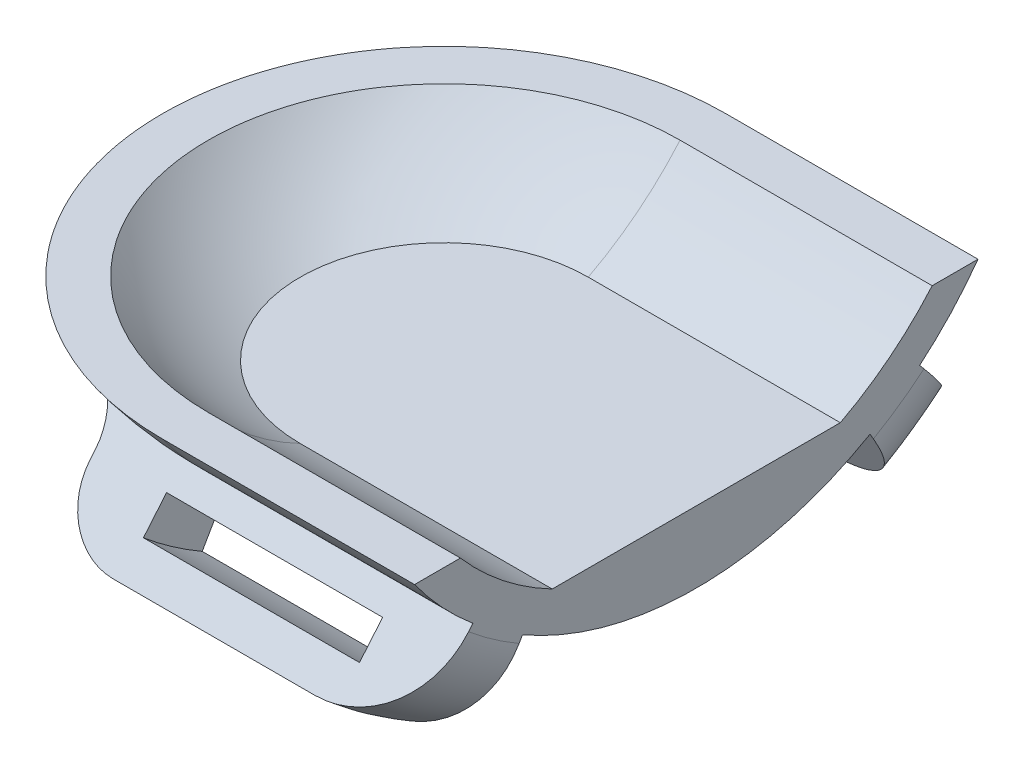
from build123d import *

# Parameters (mm, degrees)
SKETCH2_R                            = 12.2555
SKETCH2_R_2                          = 10.985499999999998
BOSS_EXTRUDE2_DEPTH                  = 15.239999999999998
CUT_EXTRUDE1_DEPTH                   = 24.079258231147723
CUT_EXTRUDE1_DEPTH_BACK              = 24.079258231147723
SKETCH6_W                            = 19.050000000000004
SKETCH6_H                            = 6.349999999999999
BOSS_EXTRUDE3_DEPTH                  = 11.43
BOSS_EXTRUDE3_DIRECTION_2_REACH      = 32.02
BOSS_EXTRUDE3_DIRECTION_2_END_RADIUS = 12.2555
SKETCH7_R                            = 1.4605000000000004
CUT_EXTRUDE3_DEPTH                   = 31.810720873585545
BOSS_EXTRUDE5_REACH                  = 32.02
LPATTERN1_COUNT                      = 3
LPATTERN1_PITCH                      = 5.334
CUT_EXTRUDE4_DEPTH                   = 35.034282139484006
FILLET5_R                            = 5.08
FILLET6_R                            = 2.54
BOSS_EXTRUDE6_REACH                  = 36.034
CUT_EXTRUDE5_DEPTH                   = 31.81072095045976
CUT_EXTRUDE5_DEPTH_BACK              = 31.81072095045976
CUT_EXTRUDE6_DEPTH                   = 31.81072095045976
CUT_EXTRUDE6_DEPTH_BACK              = 31.81072095045976
BOSS_EXTRUDE7_START                  = -12.7
BOSS_EXTRUDE7_DEPTH                  = 12.7
FILLET7_R                            = 2.286
FILLET8_R                            = 3.3019999999999996


with BuildPart() as part:
    # Sketch2 → Boss-Extrude2 (new body)
    with BuildSketch(Plane(origin=(0, 0, 0), x_dir=(0, 0, -1), z_dir=(1, 0, 0))):
        with Locations(Location((0, 0, 0), (0, 0, 180))):
            Circle(SKETCH2_R)
        with Locations(Location((0, 0, 0), (0, 0, 180))):
            Circle(SKETCH2_R_2, mode=Mode.SUBTRACT)
    extrude(amount=BOSS_EXTRUDE2_DEPTH)

    # Sketch3 → Revolve1 (revolve)
    with BuildSketch(Plane(origin=(0, 0, 0), x_dir=(1, 0, 0), z_dir=(0, 1, 0))):
        with BuildLine():
            Line((-12.2555, -1.5e-15), (-10.985499999999998, -1.35e-15))
            ThreePointArc((-10.985499999999998, 1.35e-15), (-7.767921544724782, 7.767921544724851), (9.58e-14, 10.985499999999998))
            Line((6.22e-15, 10.985499999999998), (6.94e-15, 12.2555))
            ThreePointArc((6.19e-15, 12.2555), (-8.665947156831733, 8.665947156831734), (-12.2555, 1.5e-15))
        make_face()
    revolve(axis=Axis((0, 0, 0), (-1, 0, 1.2e-16)))

    # Sketch4 → Cut-Extrude1 (cut, two sides: drawn at the far end of the back side and taken through both)
    with BuildSketch(Plane(origin=(0, 0, 0), x_dir=(1, 0, 0), z_dir=(0, 1, 0)).offset(-CUT_EXTRUDE1_DEPTH_BACK)):
        Polygon((15.239999999999998, 12.2555), (8.889999999999999, 12.255500000000001), (8.890000000000002, -12.255499999999998), (15.240000000000002, -12.2555), align=None)
    extrude(amount=CUT_EXTRUDE1_DEPTH + CUT_EXTRUDE1_DEPTH_BACK, mode=Mode.SUBTRACT)

    # Sketch6 → Boss-Extrude3 (add)
    with BuildSketch(Plane(origin=(0, 12.255499999999998, 0), x_dir=(1, 0, 0), z_dir=(0, 1, 0))):
        with Locations((-0.6349999999999953, 0)):
            Rectangle(SKETCH6_W, SKETCH6_H)
    extrude(amount=BOSS_EXTRUDE3_DEPTH)

    # Boss-Extrude3 direction 2: up to this cylinder (the profile starts outside it)
    boss_extrude3_direction_2_end = Plane(origin=(-0.6349999999999998, 0, 0), z_dir=(-1, 0, 0)) * Cylinder(BOSS_EXTRUDE3_DIRECTION_2_END_RADIUS, 89.551, mode=Mode.PRIVATE)
    # Sketch6 → Boss-Extrude3 direction 2 (add, up to the surface)
    with BuildSketch(Plane(origin=(0, 12.255499999999998, 0), x_dir=(1, 0, 0), z_dir=(0, 1, 0)), mode=Mode.PRIVATE) as boss_extrude3_direction_2_sk1:
        with Locations((-0.6349999999999953, 0)):
            Rectangle(SKETCH6_W, SKETCH6_H)
    boss_extrude3_direction_2_tool1 = extrude(boss_extrude3_direction_2_sk1.sketch, amount=-BOSS_EXTRUDE3_DIRECTION_2_REACH, mode=Mode.PRIVATE) - boss_extrude3_direction_2_end
    add(boss_extrude3_direction_2_tool1.solids().sort_by_distance((-0.635, 12.2555, 0))[0])
    add(boss_extrude3_direction_2_tool1.solids().sort_by_distance((-0.635, 12.2555, 0))[1])

    # Sketch7 → Cut-Extrude3 (cut, through all)
    with BuildSketch(Plane.XY.offset(3.175)):
        with Locations((4.889500000000005, 19.685)):
            Circle(SKETCH7_R)
    cut_extrude3 = extrude(amount=-CUT_EXTRUDE3_DEPTH, mode=Mode.SUBTRACT)

    # Sketch10 → Boss-Extrude5 (add, up to next)
    with BuildSketch(Plane(origin=(0, 12.255499999999998, 0), x_dir=(1, 0, 0), z_dir=(0, 1, 0)), mode=Mode.PRIVATE) as boss_extrude5_sk1:
        Polygon((8.83e-15, -3.175), (8.05e-15, 3.175), (-10.159999999999993, 3.175), (-10.159999999999997, -3.175), align=None)
    boss_extrude5_tool1 = extrude(boss_extrude5_sk1.sketch, amount=-BOSS_EXTRUDE5_REACH, mode=Mode.PRIVATE) - part.part
    add(boss_extrude5_tool1.solids().sort_by_distance((-5.08, 12.2555, 0))[0])

    # LPattern1: Cut-Extrude3 ×3
    with Locations(*[(-i * LPATTERN1_PITCH, 0, 0) for i in range(1, LPATTERN1_COUNT)]):
        add(cut_extrude3, mode=Mode.SUBTRACT)

    # Sketch8 → Cut-Extrude4 (cut, through all)
    with BuildSketch(Plane(origin=(8.89, 0, -1.26e-15), x_dir=(-1.1e-16, 0, -1), z_dir=(1, 0, -1.1e-16))):
        Polygon((-1.5875, 23.685499999999998), (1.5875, 23.685499999999998), (1.5874999999999988, 16.0655), (-1.5874999999999988, 16.0655), align=None)
    extrude(amount=-CUT_EXTRUDE4_DEPTH, mode=Mode.SUBTRACT)

    # Fillet5
    fillet5_edges = [part.edges().sort_by_distance(p)[0] for p in [
        (8.890000000000006, 23.685499999999998, 2.381249999999999),
        (-10.159999999999997, 23.685499999999998, -2.3812499999999996),
        (8.890000000000006, 23.685499999999998, -2.3812500000000005),
        (-10.159999999999997, 23.685499999999998, 2.3812500000000005),
    ]]
    fillet(fillet5_edges, radius=FILLET5_R)

    # Fillet6
    fillet6_edges = [part.edges().sort_by_distance(p)[0] for p in [
        (4.445000000000007, 11.83708812377436, -3.175),
        (4.445000000000007, 11.83708812377436, 3.175),
        (-5.840399850139422, 10.29594021158298, -3.175),
        (-5.840399850139422, 10.295940211582979, 3.175),
        (-10.159999999999995, 6.853588859130672, 4.2e-15),
    ]]
    fillet(fillet6_edges, radius=FILLET6_R)

    # Sketch11 → Boss-Extrude6 (add, up to next)
    with BuildSketch(Plane(origin=(8.89, 0, -1.26e-15), x_dir=(-1.5e-16, 0, -1), z_dir=(1, 0, -1.5e-16)), mode=Mode.PRIVATE) as boss_extrude6_sk1:
        with BuildLine():
            Line((5.08, -9.740370129004337), (-5.08, -9.740370129004337))
            ThreePointArc((-5.080000000000005, -9.740370129004335), (-3.31e-15, -10.985499999999998), (5.08, -9.740370129004337))
        make_face()
    boss_extrude6_tool1 = extrude(boss_extrude6_sk1.sketch, amount=-BOSS_EXTRUDE6_REACH, mode=Mode.PRIVATE) - part.part
    add(boss_extrude6_tool1.solids().sort_by_distance((8.89, -10.240924, 0))[0])

    # Sketch13 → Cut-Extrude5 (cut, two sides: drawn at the far end of the back side and taken through both)
    with BuildSketch(Plane.XY.offset(3.175).offset(-CUT_EXTRUDE5_DEPTH_BACK)):
        with BuildLine():
            Line((6.350000000000005, 14.795499999999999), (-1.2699999999999942, 14.7955))
            Line((-1.2699999999999942, 14.7955), (-1.2699999999999942, 13.587961408909038))
            ThreePointArc((-1.269999999999727, 13.587961408909017), (-0.6356900108532129, 13.632369326720188), (9.77e-15, 13.647182685448303))
            Line((1.089e-14, 13.647182685448303), (6.350000000000005, 13.647182685448303))
            Line((6.350000000000005, 13.647182685448303), (6.350000000000005, 14.795499999999999))
        make_face()
        with BuildLine():
            ThreePointArc((9.77e-15, 13.647182685448303), (-0.6356900108532129, 13.632369326720188), (-1.269999999999727, 13.587961408909017))
            Line((-1.2699999999999942, 13.587961408909038), (-1.269999999999994, 12.2555))
            Line((-1.269999999999994, 12.2555), (6.350000000000005, 12.2555))
            Line((6.350000000000005, 12.2555), (6.350000000000005, 13.647182685448303))
            Line((6.350000000000005, 13.647182685448303), (1.089e-14, 13.647182685448303))
        make_face()
    extrude(amount=CUT_EXTRUDE5_DEPTH + CUT_EXTRUDE5_DEPTH_BACK, mode=Mode.SUBTRACT)

    # Sketch14 → Cut-Extrude6 (cut, two sides: drawn at the far end of the back side and taken through both)
    with BuildSketch(Plane.XY.offset(3.175).offset(-CUT_EXTRUDE6_DEPTH_BACK)):
        Polygon((8.89, -7.175499999999997), (-12.255499999999998, -7.175499999999999), (-12.255500000000003, 23.685499999999998), (8.889999999999999, 23.685500000000005), align=None)
    extrude(amount=CUT_EXTRUDE6_DEPTH + CUT_EXTRUDE6_DEPTH_BACK, mode=Mode.SUBTRACT)

    # Sketch16 → Boss-Extrude7 (add)
    with BuildSketch(Plane(origin=(8.89, 0, -1.26e-15), x_dir=(-1.4e-16, 0, -1), z_dir=(1, 0, -1.4e-16)).offset(BOSS_EXTRUDE7_START)):
        with BuildLine():
            ThreePointArc((-7.397750000000142, -12.813278861692577), (-8.486350164031906, -12.119764071277773), (-9.510364079117075, -11.334010558166936))
            Line((-9.510364079117169, -11.334010558166854), (-10.153151688803709, -12.100055001285837))
            ThreePointArc((-10.153151688803714, -12.100055001285833), (-9.059926600382918, -12.93891611556679), (-7.89774999999997, -13.679304265477118))
            Line((-7.897749999999964, -13.679304265477123), (-7.397749999999962, -12.813278861692677))
        make_face()
        with BuildLine():
            ThreePointArc((-6.127749999999821, -10.61357433608029), (-7.029466015700107, -10.039117878783834), (-7.877683550513282, -9.38825767264472))
            Line((-7.877683550513363, -9.388257672644649), (-9.510364079117169, -11.334010558166854))
            ThreePointArc((-9.510364079117075, -11.334010558166936), (-8.486350164031906, -12.119764071277773), (-7.397750000000142, -12.813278861692577))
            Line((-7.397749999999962, -12.813278861692677), (-6.1277499999999705, -10.613574336080204))
        make_face()
        with BuildLine():
            ThreePointArc((-5.492750000000139, -9.513722073273868), (-6.301023941534394, -8.998794782536732), (-7.061343286211322, -8.415381229883662))
            Line((-7.06134328621146, -8.415381229883545), (-7.877683550513363, -9.388257672644649))
            ThreePointArc((-7.877683550513282, -9.38825767264472), (-7.029466015700107, -10.039117878783834), (-6.127749999999821, -10.61357433608029))
            Line((-6.1277499999999705, -10.613574336080204), (-5.492749999999971, -9.51372207327396))
        make_face()
        with BuildLine():
            ThreePointArc((7.061343286211319, -8.415381229883664), (6.3010239415344, -8.998794782536729), (5.492750000000143, -9.513722073273867))
            Line((5.492749999999974, -9.513722073273968), (6.127749999999969, -10.613574336080204))
            ThreePointArc((6.127749999999821, -10.613574336080289), (7.029466015700105, -10.039117878783832), (7.877683550513282, -9.388257672644716))
            Line((7.8776835505133604, -9.388257672644645), (7.061343286211458, -8.415381229883542))
        make_face()
        with BuildLine():
            ThreePointArc((7.877683550513282, -9.388257672644716), (7.029466015700105, -10.039117878783832), (6.127749999999821, -10.613574336080289))
            Line((6.127749999999969, -10.613574336080204), (7.397749999999963, -12.813278861692682))
            ThreePointArc((7.397750000000137, -12.81327886169258), (8.486350164031892, -12.119764071277785), (9.510364079117059, -11.33401055816695))
            Line((9.510364079117169, -11.334010558166854), (7.8776835505133604, -9.388257672644645))
        make_face()
        with BuildLine():
            ThreePointArc((9.510364079117059, -11.33401055816695), (8.486350164031892, -12.119764071277785), (7.397750000000137, -12.81327886169258))
            Line((7.397749999999963, -12.813278861692682), (7.897749999999962, -13.679304265477123))
            ThreePointArc((7.897749999999966, -13.679304265477121), (9.059926600382914, -12.938916115566794), (10.15315168880371, -12.100055001285837))
            Line((10.153151688803709, -12.100055001285837), (9.510364079117169, -11.334010558166854))
        make_face()
    extrude(amount=BOSS_EXTRUDE7_DEPTH)

    # Sketch17 → Cut-Revolve1 (revolve, cut)
    with BuildSketch(Plane(origin=(0, 0, 0), x_dir=(1, -7e-17, -8e-17), z_dir=(0, 0.6427876096865381, 0.7660444431189791))):
        Polygon((-1.269999999999997, -13.255499999999996), (6.350000000000001, -13.255499999999996), (6.350000000000001, -14.525499999999997), (-1.269999999999997, -14.525499999999996), align=None)
    revolve(axis=Axis((8.890000000000002, 0, 0), (-1, 0, 0)), mode=Mode.SUBTRACT)

    # Fillet7
    fillet7_edges = [part.edges().sort_by_distance(p)[0] for p in [
        (-3.809999999999998, -9.541668537674667, 6.681148237178193),
        (-3.8099999999999974, -12.938916115566784, 9.059926600382923),
        (-3.8099999999999996, -9.541668537674669, -6.681148237178193),
        (-3.81, -12.938916115566787, -9.059926600382923),
    ]]
    fillet(fillet7_edges, radius=FILLET7_R)

    # Fillet8
    fillet8_edges = [part.edges().sort_by_distance(p)[0] for p in [
        (8.890000000000002, -12.938916115566784, 9.059926600382921),
        (8.889999999999999, -12.938916115566787, -9.059926600382925),
    ]]
    fillet(fillet8_edges, radius=FILLET8_R)


solid = part.part
